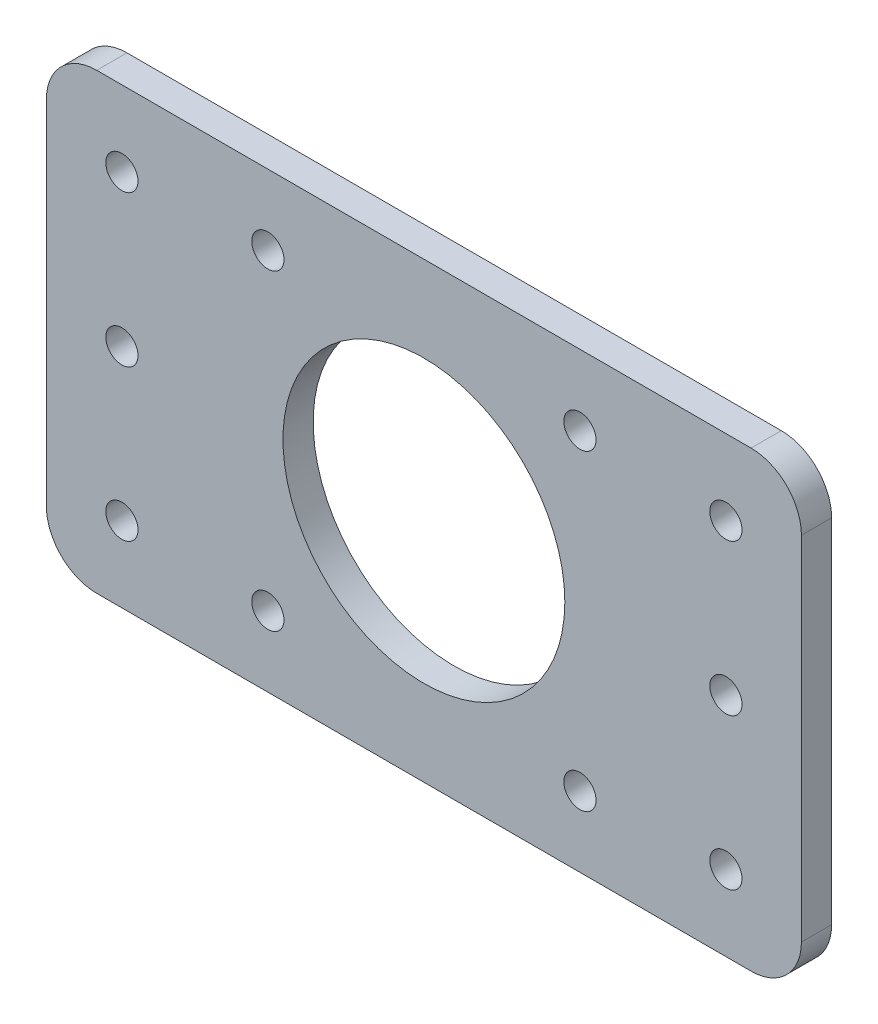
from build123d import *

# Parameters (mm, degrees)
SKETCH1_W           = 75
SKETCH1_H           = 45
SKETCH1_R           = 14
SKETCH1_R_2         = 1.6
BOSS_EXTRUDE1_DEPTH = 3
FILLET2_R           = 5
SKETCH2_R           = 1.6
CUT_EXTRUDE1_DEPTH  = 44.834917589


with BuildPart() as part:
    # Sketch1 → Boss-Extrude1 (new body)
    with BuildSketch(Plane.XY):
        Rectangle(SKETCH1_W, SKETCH1_H)
        Circle(SKETCH1_R, mode=Mode.SUBTRACT)
        with Locations((-15.5, 15.5)):
            Circle(SKETCH1_R_2, mode=Mode.SUBTRACT)
        with Locations((15.5, 15.5)):
            Circle(SKETCH1_R_2, mode=Mode.SUBTRACT)
        with Locations((15.5, -15.5)):
            Circle(SKETCH1_R_2, mode=Mode.SUBTRACT)
        with Locations((-15.5, -15.5)):
            Circle(SKETCH1_R_2, mode=Mode.SUBTRACT)
    extrude(amount=BOSS_EXTRUDE1_DEPTH)

    # Fillet2
    fillet2_edges = [part.edges().sort_by_distance(p)[0] for p in [
        (37.5, -22.5, 1.5),
        (-37.5, -22.5, 1.5),
        (-37.5, 22.5, 1.5),
        (37.5, 22.5, 1.5),
    ]]
    fillet(fillet2_edges, radius=FILLET2_R)

    # Sketch2 → Cut-Extrude1 (cut, through all)
    with BuildSketch(Plane.XY.offset(3)):
        with Locations((-30, 0)):
            Circle(SKETCH2_R)
        with Locations((-30, 15)):
            Circle(SKETCH2_R)
        with Locations(Location((-30, -15, 0), (0, 0, 180))):
            Circle(SKETCH2_R)
        with Locations((30, -15)):
            Circle(SKETCH2_R)
        with Locations(Location((30, 15, 0), (0, 0, 180))):
            Circle(SKETCH2_R)
        with Locations(Location((30, 0, 0), (0, 0, 180))):
            Circle(SKETCH2_R)
    extrude(amount=-CUT_EXTRUDE1_DEPTH, mode=Mode.SUBTRACT)


solid = part.part
